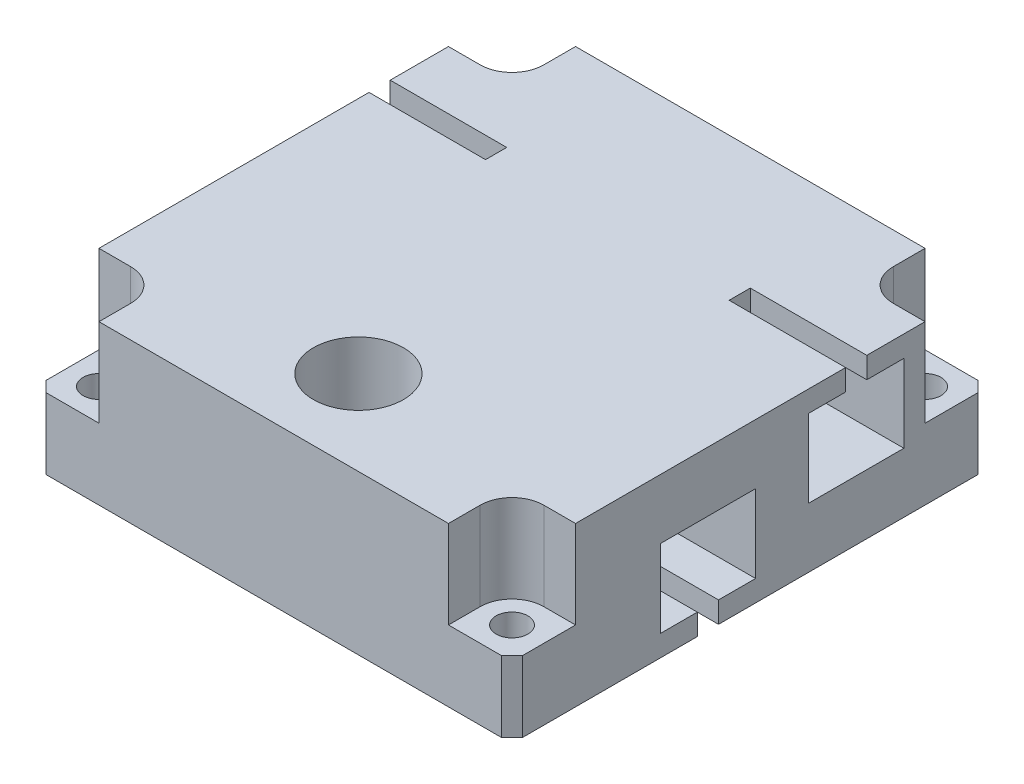
from build123d import *

# Parameters (mm, degrees)
SKETCH_1_W          = 45
SKETCH_1_H          = 39
EXTRUDE_1_DEPTH     = 15
CUT_EXTRUDE_1_DEPTH = 11
SKETCH_3_R          = 1.85
CUT_EXTRUDE_2_DEPTH = 3
SKETCH_4_R          = 1.25
CUT_EXTRUDE_3_DEPTH = 40.575876491
SKETCH_5_R          = 8
CUT_EXTRUDE_4_DEPTH = 12
SKETCH_6_R          = 2.5
EXTRUDE_2_DEPTH     = 1
SKETCH_7_R          = 1.5
EXTRUDE_3_DEPTH     = 1.8
SKETCH_8_W          = 45
SKETCH_8_H          = 15
EXTRUDE_4_DEPTH     = 6
SKETCH_10_R         = 1.5
CUT_EXTRUDE_5_DEPTH = 38.16853512
CUT_EXTRUDE_6_DEPTH = 8.3
SKETCH_12_R         = 4.25
CUT_EXTRUDE_7_DEPTH = 38.16853508
CHAMFER_4_SIZE      = 2
CHAMFER_2_SIZE      = 0.5
CHAMFER_3_SIZE      = 1


with BuildPart() as part:
    # 草图1 → 凸台-拉伸1 (new body)
    with BuildSketch(Plane(origin=(0, 0, 0), x_dir=(1, 0, 0), z_dir=(0, 1, 0))):
        Rectangle(SKETCH_1_W, SKETCH_1_H)
    extrude(amount=EXTRUDE_1_DEPTH)

    # 草图2 → 切除-拉伸1 (cut)
    with BuildSketch(Plane.ZY.offset(22.5)):
        Polygon((-8, 13), (-8, 15), (-6, 15), (-6, 13), (-2.5, 13), (-2.5, 5.65), (-11.5, 5.65), (-11.5, 13), align=None)
        Polygon((6, 2), (6, 0), (8, 0), (8, 2), (11.5, 2), (11.5, 9.35), (2.5, 9.35), (2.5, 2), align=None)
    cut_extrude_1 = extrude(amount=-CUT_EXTRUDE_1_DEPTH, mode=Mode.SUBTRACT)

    # 草图3 → 切除-拉伸2 (cut)
    with BuildSketch(Plane.ZY.offset(11.5)):
        with Locations((-7, 9.325)):
            Circle(SKETCH_3_R)
        with Locations((7, 5.675)):
            Circle(SKETCH_3_R)
    cut_extrude_2 = extrude(amount=-CUT_EXTRUDE_2_DEPTH, mode=Mode.SUBTRACT)

    # 草图4 → 切除-拉伸3 (cut, through all)
    with BuildSketch(Plane.ZY.offset(8.5)):
        with Locations((-7, 9.325)):
            Circle(SKETCH_4_R)
        with Locations((7, 5.675)):
            Circle(SKETCH_4_R)
    extrude(amount=-CUT_EXTRUDE_3_DEPTH, mode=Mode.SUBTRACT)

    # 镜向1: 切除-拉伸1, 切除-拉伸2 across plane
    add(cut_extrude_1.mirror(Plane(origin=(0, 0, 0), x_dir=(0, 0, 1), z_dir=(1, 0, 0))), mode=Mode.SUBTRACT)
    add(cut_extrude_2.mirror(Plane(origin=(0, 0, 0), x_dir=(0, 0, 1), z_dir=(1, 0, 0))), mode=Mode.SUBTRACT)

    # 草图5 → 切除-拉伸4 (cut)
    with BuildSketch(Plane.XZ):
        with Locations(Location((0, 0, 0), (0, 0, 270))):
            Circle(SKETCH_5_R)
    extrude(amount=-CUT_EXTRUDE_4_DEPTH, mode=Mode.SUBTRACT)

    # 草图6 → 凸台-拉伸2 (add)
    with BuildSketch(Plane.XZ.offset(-12)):
        with Locations(Location((0, 0, 0), (0, 0, 270))):
            Circle(SKETCH_6_R)
    extrude(amount=EXTRUDE_2_DEPTH)

    # 草图7 → 凸台-拉伸3 (add)
    with BuildSketch(Plane.XZ.offset(-11)):
        with Locations(Location((0, 0, 0), (0, 0, 270))):
            Circle(SKETCH_7_R)
    extrude(amount=EXTRUDE_3_DEPTH)

    # 草图8 → 凸台-拉伸4 (add)
    with BuildSketch(Plane.XY.offset(19.5)):
        with Locations((0, 7.5)):
            Rectangle(SKETCH_8_W, SKETCH_8_H)
    extrude(amount=EXTRUDE_4_DEPTH)

    # 草图10 → 切除-拉伸5 (cut, through all)
    with BuildSketch(Plane(origin=(0, 15, 0), x_dir=(1, 0, 0), z_dir=(0, 1, 0))):
        with Locations(Location((-19.5, 16.5, 0), (0, 0, 270))):
            Circle(SKETCH_10_R)
        with Locations(Location((19.5, 16.5, 0), (0, 0, 90))):
            Circle(SKETCH_10_R)
        with Locations(Location((19.5, -22.5, 0), (0, 0, 270))):
            Circle(SKETCH_10_R)
        with Locations(Location((-19.5, -22.5, 0), (0, 0, 90))):
            Circle(SKETCH_10_R)
    extrude(amount=-CUT_EXTRUDE_5_DEPTH, mode=Mode.SUBTRACT)

    # 草图11 → 切除-拉伸6 (cut)
    with BuildSketch(Plane(origin=(0, 15, 0), x_dir=(1, 0, 0), z_dir=(0, 1, 0))):
        with BuildLine():
            Line((-16.5, 16.5), (-16.5, 19.5))
            Line((-16.5, 19.5), (-22.5, 19.5))
            Line((-22.5, 19.5), (-22.5, 13.5))
            Line((-22.5, 13.5), (-19.5, 13.5))
            ThreePointArc((-19.5, 13.5), (-17.378679656, 14.378679656), (-16.5, 16.5))
        make_face()
        with BuildLine():
            Line((22.5, 19.5), (22.5, 13.5))
            Line((22.5, 13.5), (19.5, 13.5))
            ThreePointArc((19.5, 13.5), (17.378679656, 14.378679656), (16.5, 16.5))
            Line((16.5, 16.5), (16.5, 19.5))
            Line((16.5, 19.5), (22.5, 19.5))
        make_face()
        with BuildLine():
            Line((16.5, -25.5), (22.5, -25.5))
            Line((22.5, -25.5), (22.5, -19.5))
            Line((22.5, -19.5), (19.5, -19.5))
            ThreePointArc((19.5, -19.5), (17.378679656, -20.378679656), (16.5, -22.5))
            Line((16.5, -22.5), (16.5, -25.5))
        make_face()
        with BuildLine():
            Line((-22.5, -25.5), (-22.5, -19.5))
            Line((-22.5, -19.5), (-19.5, -19.5))
            ThreePointArc((-19.5, -19.5), (-17.378679656, -20.378679656), (-16.5, -22.5))
            Line((-16.5, -22.5), (-16.5, -25.5))
            Line((-16.5, -25.5), (-22.5, -25.5))
        make_face()
    extrude(amount=-CUT_EXTRUDE_6_DEPTH, mode=Mode.SUBTRACT)

    # 草图12 → 切除-拉伸7 (cut, through all)
    with BuildSketch(Plane.XZ):
        with Locations(Location((0, 17.5, 0), (0, 0, 270))):
            Circle(SKETCH_12_R)
    extrude(amount=-CUT_EXTRUDE_7_DEPTH, mode=Mode.SUBTRACT)

    # 倒角4
    chamfer_4_edges = [part.edges().sort_by_distance(p)[0] for p in [
        (0, 0, 21.75),
    ]]
    chamfer(chamfer_4_edges, length=CHAMFER_4_SIZE)

    # 倒角2
    chamfer_2_edges = [part.edges().sort_by_distance(p)[0] for p in [
        (0, 9.2, 1.5),
    ]]
    chamfer(chamfer_2_edges, length=CHAMFER_2_SIZE)

    # 倒角3
    chamfer_3_edges = [part.edges().sort_by_distance(p)[0] for p in [
        (22.5, 3.35, 25.5),
        (-22.5, 3.35, 25.5),
        (-22.5, 3.35, -19.5),
        (22.5, 3.35, -19.5),
    ]]
    chamfer(chamfer_3_edges, length=CHAMFER_3_SIZE)


solid = part.part
